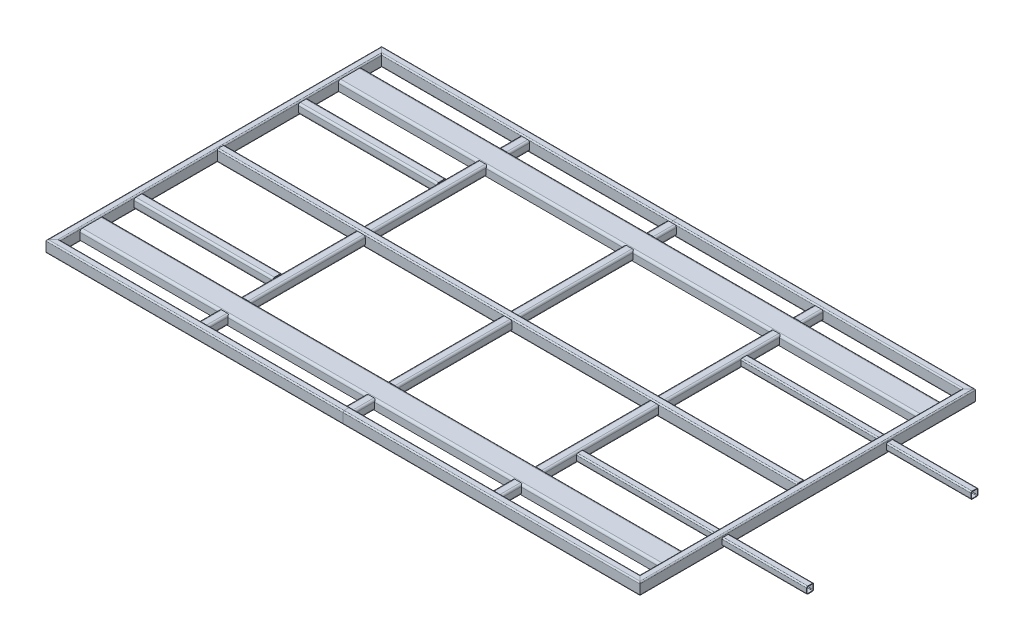
from build123d import *

# Parameters (mm, degrees)
RECTANGULAR_TUBE_CONFIGURED_50_X_30_X_DEPTH      = 1430.154759474
RECTANGULAR_TUBE_CONFIGURED_50_X_30_X_DEPTH_BACK = 30.154759474
RECTANGULAR_TUBE_CONFIGURED_50_X_3_4_DEPTH       = 1281.154759474
RECTANGULAR_TUBE_CONFIGURED_50_X_3_6_DEPTH       = 1281.154759474
RECTANGULAR_TUBE_CONFIGURED_50_X_3_8_DEPTH       = 1460.309518948
RECTANGULAR_TUBE_CONFIGURED_50_X_3_10_DEPTH      = 1281.154759474
RECTANGULAR_TUBE_CONFIGURED_50_X_3_13_DEPTH      = 1281.154759474
RECTANGULAR_TUBE_CONFIGURED_50_X_3_16_DEPTH      = 2502
BOSS_EXTRUDE1_DEPTH                              = 2470
FILLET1_R                                        = 10
CUT_EXTRUDE1_DEPTH                               = 30
FILLET1_OF_MIRROR1_R                             = 10
SQUARE_TUBE_CONFIGURED_40_X_40_X_4_1_DEPTH       = 105
SQUARE_TUBE_CONFIGURED_40_X_40_X_4_1_2_DEPTH     = 114.8
SQUARE_TUBE_CONFIGURED_40_X_40_X_4_1_3_DEPTH     = 105
SQUARE_TUBE_CONFIGURED_40_X_40_X_4_1_4_DEPTH     = 1010
SQUARE_TUBE_CONFIGURED_40_X_40_X_4_1_5_DEPTH     = 1010
SQUARE_TUBE_CONFIGURED_40_X_40_X_4_1_6_DEPTH     = 1010
SQUARE_TUBE_CONFIGURED_40_X_40_X_4_1_7_DEPTH     = 105
SQUARE_TUBE_CONFIGURED_40_X_40_X_4_1_8_DEPTH     = 105
SQUARE_TUBE_CONFIGURED_40_X_40_X_4_1_9_DEPTH     = 105
SQUARE_TUBE_CONFIGURED_40_X_40_X_4_1_1_DEPTH     = 626
SQUARE_TUBE_CONFIGURED_40_X_40_X_4_3_DEPTH       = 626
SQUARE_TUBE_CONFIGURED_30_X_30_X_2_6_1_DEPTH     = 1000
SQUARE_TUBE_CONFIGURED_30_X_30_X_2_2_DEPTH       = 1000


with BuildPart() as part:
    # Sketch1 → Rectangular tube - configured 50 X 30 X 2.6(1) (new, two sides: drawn at the far end of the back side and taken through both)
    with BuildSketch(Plane(origin=(-1250, 0, 0), x_dir=(1, 0, 0), z_dir=(0, 0, 1)).offset(-RECTANGULAR_TUBE_CONFIGURED_50_X_30_X_DEPTH_BACK)):
        with BuildLine():
            Line((-9.8, -25), (9.8, -25))
            ThreePointArc((9.8, -25), (13.476955262, -23.476955262), (15, -19.8))
            Line((15, -19.8), (15, 19.8))
            ThreePointArc((15, 19.8), (13.476955262, 23.476955262), (9.8, 25))
            Line((9.8, 25), (-9.8, 25))
            ThreePointArc((-9.8, 25), (-13.476955262, 23.476955262), (-15, 19.8))
            Line((-15, 19.8), (-15, -19.8))
            ThreePointArc((-15, -19.8), (-13.476955262, -23.476955262), (-9.8, -25))
        make_face()
        with BuildLine():
            Line((-9.8, -22.4), (9.8, -22.4))
            ThreePointArc((9.8, -22.4), (11.638477631, -21.638477631), (12.4, -19.8))
            Line((12.4, -19.8), (12.4, 19.8))
            ThreePointArc((12.4, 19.8), (11.638477631, 21.638477631), (9.8, 22.4))
            Line((9.8, 22.4), (-9.8, 22.4))
            ThreePointArc((-9.8, 22.4), (-11.638477631, 21.638477631), (-12.4, 19.8))
            Line((-12.4, 19.8), (-12.4, -19.8))
            ThreePointArc((-12.4, -19.8), (-11.638477631, -21.638477631), (-9.8, -22.4))
        make_face(mode=Mode.SUBTRACT)
    extrude(amount=RECTANGULAR_TUBE_CONFIGURED_50_X_30_X_DEPTH + RECTANGULAR_TUBE_CONFIGURED_50_X_30_X_DEPTH_BACK)

    # Rectangular tube - configured 50 X 3 2
    split(bisect_by=Plane(origin=(-1250, 0, 0), x_dir=(0, -1, 0), z_dir=(-0.707106781, 0, 0.707106781)), keep=Keep.TOP)

    # Rectangular tube - configured 50 X 3 3
    split(bisect_by=Plane(origin=(-1250, 0, 1400), x_dir=(0, -1, 0), z_dir=(-0.707106781, 0, -0.707106781)), keep=Keep.TOP)

    # Sketch115 → Cut-Extrude1 (cut, symmetric)
    with BuildSketch(Plane(origin=(-1235, 0, 0), x_dir=(0, 0, -1), z_dir=(1, 0, 0))):
        Polygon((-165, -28.2), (-135, -28.2), (-135, -11.8), (-108, -11.8), (-108, 11.8), (-192, 11.8), (-192, -11.8), (-165, -11.8), align=None)
    cut_extrude1 = extrude(amount=CUT_EXTRUDE1_DEPTH, both=True, mode=Mode.SUBTRACT)


with BuildPart() as body_2:
    # Sketch1 on segment 2 (carried to segment 2) → Rectangular tube - configured 50 X 3 4 (new body)
    with BuildSketch(Plane(origin=(-1280.154759474, 0, 1400), x_dir=(0, 0, -1), z_dir=(1, 0, 0))):
        with BuildLine():
            Line((-9.8, -25), (9.8, -25))
            ThreePointArc((9.8, -25), (13.476955262, -23.476955262), (15, -19.8))
            Line((15, -19.8), (15, 19.8))
            ThreePointArc((15, 19.8), (13.476955262, 23.476955262), (9.8, 25))
            Line((9.8, 25), (-9.8, 25))
            ThreePointArc((-9.8, 25), (-13.476955262, 23.476955262), (-15, 19.8))
            Line((-15, 19.8), (-15, -19.8))
            ThreePointArc((-15, -19.8), (-13.476955262, -23.476955262), (-9.8, -25))
        make_face()
        with BuildLine():
            Line((-9.8, -22.4), (9.8, -22.4))
            ThreePointArc((9.8, -22.4), (11.638477631, -21.638477631), (12.4, -19.8))
            Line((12.4, -19.8), (12.4, 19.8))
            ThreePointArc((12.4, 19.8), (11.638477631, 21.638477631), (9.8, 22.4))
            Line((9.8, 22.4), (-9.8, 22.4))
            ThreePointArc((-9.8, 22.4), (-11.638477631, 21.638477631), (-12.4, 19.8))
            Line((-12.4, 19.8), (-12.4, -19.8))
            ThreePointArc((-12.4, -19.8), (-11.638477631, -21.638477631), (-9.8, -22.4))
        make_face(mode=Mode.SUBTRACT)
    extrude(amount=RECTANGULAR_TUBE_CONFIGURED_50_X_3_4_DEPTH)

    # Rectangular tube - configured 50 X 3 4 m
    split(bisect_by=Plane(origin=(-1250, 0, 1400), x_dir=(0, 1, 0), z_dir=(0.707106781, 0, 0.707106781)), keep=Keep.TOP)

    # Rectangular tube - configured 50 X 3 5
    split(bisect_by=Plane(origin=(0, 0, 1400), x_dir=(0, -1, 0), z_dir=(-1, 0, 0)), keep=Keep.TOP)


with BuildPart() as body_3:
    # Sketch1 on segment 3 (carried to segment 3) → Rectangular tube - configured 50 X 3 6 (new body)
    with BuildSketch(Plane(origin=(-1, 0, 1400), x_dir=(0, 0, -1), z_dir=(1, 0, 0))):
        with BuildLine():
            Line((-9.8, -25), (9.8, -25))
            ThreePointArc((9.8, -25), (13.476955262, -23.476955262), (15, -19.8))
            Line((15, -19.8), (15, 19.8))
            ThreePointArc((15, 19.8), (13.476955262, 23.476955262), (9.8, 25))
            Line((9.8, 25), (-9.8, 25))
            ThreePointArc((-9.8, 25), (-13.476955262, 23.476955262), (-15, 19.8))
            Line((-15, 19.8), (-15, -19.8))
            ThreePointArc((-15, -19.8), (-13.476955262, -23.476955262), (-9.8, -25))
        make_face()
        with BuildLine():
            Line((-9.8, -22.4), (9.8, -22.4))
            ThreePointArc((9.8, -22.4), (11.638477631, -21.638477631), (12.4, -19.8))
            Line((12.4, -19.8), (12.4, 19.8))
            ThreePointArc((12.4, 19.8), (11.638477631, 21.638477631), (9.8, 22.4))
            Line((9.8, 22.4), (-9.8, 22.4))
            ThreePointArc((-9.8, 22.4), (-11.638477631, 21.638477631), (-12.4, 19.8))
            Line((-12.4, 19.8), (-12.4, -19.8))
            ThreePointArc((-12.4, -19.8), (-11.638477631, -21.638477631), (-9.8, -22.4))
        make_face(mode=Mode.SUBTRACT)
    extrude(amount=RECTANGULAR_TUBE_CONFIGURED_50_X_3_6_DEPTH)

    # Rectangular tube - configured 50 X 3 6 m
    split(bisect_by=Plane(origin=(0, 0, 1400), x_dir=(0, 1, 0), z_dir=(1, 0, 0)), keep=Keep.TOP)

    # Rectangular tube - configured 50 X 3 7
    split(bisect_by=Plane(origin=(1250, 0, 1400), x_dir=(0, -1, 0), z_dir=(-0.707106781, 0, 0.707106781)), keep=Keep.TOP)


with BuildPart() as body_4:
    # Sketch1 on segment 4 (carried to segment 4) → Rectangular tube - configured 50 X 3 8 (new body)
    with BuildSketch(Plane(origin=(1250, 0, 1430.154759474), x_dir=(-1, 0, 0), z_dir=(0, 0, -1))):
        with BuildLine():
            Line((-9.8, -25), (9.8, -25))
            ThreePointArc((9.8, -25), (13.476955262, -23.476955262), (15, -19.8))
            Line((15, -19.8), (15, 19.8))
            ThreePointArc((15, 19.8), (13.476955262, 23.476955262), (9.8, 25))
            Line((9.8, 25), (-9.8, 25))
            ThreePointArc((-9.8, 25), (-13.476955262, 23.476955262), (-15, 19.8))
            Line((-15, 19.8), (-15, -19.8))
            ThreePointArc((-15, -19.8), (-13.476955262, -23.476955262), (-9.8, -25))
        make_face()
        with BuildLine():
            Line((-9.8, -22.4), (9.8, -22.4))
            ThreePointArc((9.8, -22.4), (11.638477631, -21.638477631), (12.4, -19.8))
            Line((12.4, -19.8), (12.4, 19.8))
            ThreePointArc((12.4, 19.8), (11.638477631, 21.638477631), (9.8, 22.4))
            Line((9.8, 22.4), (-9.8, 22.4))
            ThreePointArc((-9.8, 22.4), (-11.638477631, 21.638477631), (-12.4, 19.8))
            Line((-12.4, 19.8), (-12.4, -19.8))
            ThreePointArc((-12.4, -19.8), (-11.638477631, -21.638477631), (-9.8, -22.4))
        make_face(mode=Mode.SUBTRACT)
    extrude(amount=RECTANGULAR_TUBE_CONFIGURED_50_X_3_8_DEPTH)

    # Rectangular tube - configured 50 X 3 8 m
    split(bisect_by=Plane(origin=(1250, 0, 0), x_dir=(0, 1, 0), z_dir=(0.707106781, 0, 0.707106781)), keep=Keep.TOP)

    # Rectangular tube - configured 50 X 3 9
    split(bisect_by=Plane(origin=(1250, 0, 1400), x_dir=(0, 1, 0), z_dir=(0.707106781, 0, -0.707106781)), keep=Keep.TOP)


with BuildPart() as body_5:
    # Sketch1 on segment 5 (carried to segment 5) → Rectangular tube - configured 50 X 3 10 (new body)
    with BuildSketch(Plane.ZY.offset(-1280.154759474)):
        with BuildLine():
            Line((-9.8, -25), (9.8, -25))
            ThreePointArc((9.8, -25), (13.476955262, -23.476955262), (15, -19.8))
            Line((15, -19.8), (15, 19.8))
            ThreePointArc((15, 19.8), (13.476955262, 23.476955262), (9.8, 25))
            Line((9.8, 25), (-9.8, 25))
            ThreePointArc((-9.8, 25), (-13.476955262, 23.476955262), (-15, 19.8))
            Line((-15, 19.8), (-15, -19.8))
            ThreePointArc((-15, -19.8), (-13.476955262, -23.476955262), (-9.8, -25))
        make_face()
        with BuildLine():
            Line((-9.8, -22.4), (9.8, -22.4))
            ThreePointArc((9.8, -22.4), (11.638477631, -21.638477631), (12.4, -19.8))
            Line((12.4, -19.8), (12.4, 19.8))
            ThreePointArc((12.4, 19.8), (11.638477631, 21.638477631), (9.8, 22.4))
            Line((9.8, 22.4), (-9.8, 22.4))
            ThreePointArc((-9.8, 22.4), (-11.638477631, 21.638477631), (-12.4, 19.8))
            Line((-12.4, 19.8), (-12.4, -19.8))
            ThreePointArc((-12.4, -19.8), (-11.638477631, -21.638477631), (-9.8, -22.4))
        make_face(mode=Mode.SUBTRACT)
    extrude(amount=RECTANGULAR_TUBE_CONFIGURED_50_X_3_10_DEPTH)

    # Rectangular tube - configured 50 X 3 11
    split(bisect_by=Plane.YZ, keep=Keep.TOP)

    # Rectangular tube - configured 50 X 3 12
    split(bisect_by=Plane(origin=(1250, 0, 0), x_dir=(0, -1, 0), z_dir=(-0.707106781, 0, -0.707106781)), keep=Keep.TOP)


with BuildPart() as body_6:
    # Sketch1 on segment 6 (carried to segment 6) → Rectangular tube - configured 50 X 3 13 (new body)
    with BuildSketch(Plane.ZY.offset(-1)):
        with BuildLine():
            Line((-9.8, -25), (9.8, -25))
            ThreePointArc((9.8, -25), (13.476955262, -23.476955262), (15, -19.8))
            Line((15, -19.8), (15, 19.8))
            ThreePointArc((15, 19.8), (13.476955262, 23.476955262), (9.8, 25))
            Line((9.8, 25), (-9.8, 25))
            ThreePointArc((-9.8, 25), (-13.476955262, 23.476955262), (-15, 19.8))
            Line((-15, 19.8), (-15, -19.8))
            ThreePointArc((-15, -19.8), (-13.476955262, -23.476955262), (-9.8, -25))
        make_face()
        with BuildLine():
            Line((-9.8, -22.4), (9.8, -22.4))
            ThreePointArc((9.8, -22.4), (11.638477631, -21.638477631), (12.4, -19.8))
            Line((12.4, -19.8), (12.4, 19.8))
            ThreePointArc((12.4, 19.8), (11.638477631, 21.638477631), (9.8, 22.4))
            Line((9.8, 22.4), (-9.8, 22.4))
            ThreePointArc((-9.8, 22.4), (-11.638477631, 21.638477631), (-12.4, 19.8))
            Line((-12.4, 19.8), (-12.4, -19.8))
            ThreePointArc((-12.4, -19.8), (-11.638477631, -21.638477631), (-9.8, -22.4))
        make_face(mode=Mode.SUBTRACT)
    extrude(amount=RECTANGULAR_TUBE_CONFIGURED_50_X_3_13_DEPTH)

    # Rectangular tube - configured 50 X 3 14
    split(bisect_by=Plane(origin=(-1250, 0, 0), x_dir=(0, 1, 0), z_dir=(0.707106781, 0, -0.707106781)), keep=Keep.TOP)

    # Rectangular tube - configured 50 X 3 15
    split(bisect_by=Plane(origin=(0, 0, 0), x_dir=(0, -1, 0), z_dir=(-1, 0, 0)), keep=Keep.TOP)


with BuildPart() as body_7:
    # Sketch1 on segment 7 (carried to segment 7) → Rectangular tube - configured 50 X 3 16 (new body)
    with BuildSketch(Plane(origin=(1251, 0, 700), x_dir=(0, 0, 1), z_dir=(-1, 0, 0))):
        with BuildLine():
            Line((-9.8, -25), (9.8, -25))
            ThreePointArc((9.8, -25), (13.476955262, -23.476955262), (15, -19.8))
            Line((15, -19.8), (15, 19.8))
            ThreePointArc((15, 19.8), (13.476955262, 23.476955262), (9.8, 25))
            Line((9.8, 25), (-9.8, 25))
            ThreePointArc((-9.8, 25), (-13.476955262, 23.476955262), (-15, 19.8))
            Line((-15, 19.8), (-15, -19.8))
            ThreePointArc((-15, -19.8), (-13.476955262, -23.476955262), (-9.8, -25))
        make_face()
        with BuildLine():
            Line((-9.8, -22.4), (9.8, -22.4))
            ThreePointArc((9.8, -22.4), (11.638477631, -21.638477631), (12.4, -19.8))
            Line((12.4, -19.8), (12.4, 19.8))
            ThreePointArc((12.4, 19.8), (11.638477631, 21.638477631), (9.8, 22.4))
            Line((9.8, 22.4), (-9.8, 22.4))
            ThreePointArc((-9.8, 22.4), (-11.638477631, 21.638477631), (-12.4, 19.8))
            Line((-12.4, 19.8), (-12.4, -19.8))
            ThreePointArc((-12.4, -19.8), (-11.638477631, -21.638477631), (-9.8, -22.4))
        make_face(mode=Mode.SUBTRACT)
    extrude(amount=RECTANGULAR_TUBE_CONFIGURED_50_X_3_16_DEPTH)

    # Rectangular tube - configured 50 X 3 17
    split(bisect_by=Plane(origin=(1235, 0, 700), x_dir=(0, -1, 0), z_dir=(-1, 0, 0)), keep=Keep.TOP)

    # Rectangular tube - configured 50 X 3 18
    split(bisect_by=Plane(origin=(-1235, 0, 700), x_dir=(0, 1, 0), z_dir=(1, 0, 0)), keep=Keep.TOP)


with BuildPart() as body_8:
    # Sketch113 → Boss-Extrude1 (new body)
    with BuildSketch(Plane(origin=(-1235, 0, 0), x_dir=(0, 0, -1), z_dir=(1, 0, 0))):
        Polygon((-200, 19.8), (-100, 19.8), (-100, -19.8), (-135, -19.8), (-135, -11.8), (-108, -11.8), (-108, 11.8), (-192, 11.8), (-192, -11.8), (-165, -11.8), (-165, -19.8), (-200, -19.8), align=None)
    boss_extrude1 = extrude(amount=BOSS_EXTRUDE1_DEPTH)

    # Fillet1
    fillet1_edges = [body_8.edges().sort_by_distance(p)[0] for p in [
        (0, 19.8, 100),
        (0, 19.8, 200),
    ]]
    fillet(fillet1_edges, radius=FILLET1_R)


with BuildPart() as part_1:
    add(part.part)

    # Mirror1: Boss-Extrude1 across plane
    add(boss_extrude1.mirror(Plane.XY.offset(700)))

    # Mirror1 2: Cut-Extrude1 across plane
    add(cut_extrude1.mirror(Plane.XY.offset(700)), mode=Mode.SUBTRACT)

    # Fillet1 of Mirror1
    fillet1_of_mirror1_edges = [part_1.edges().sort_by_distance(p)[0] for p in [
        (0, 19.8, 1300),
        (0, 19.8, 1200),
    ]]
    fillet(fillet1_of_mirror1_edges, radius=FILLET1_OF_MIRROR1_R)


with BuildPart() as body_9:
    # Sketch119 → Square tube - configured 40 X 40 X 4(1) (new body)
    with BuildSketch(Plane(origin=(-625, 0, 0), x_dir=(1, 0, 0), z_dir=(0, 0, 1))):
        with BuildLine():
            Line((-12, -20), (12, -20))
            ThreePointArc((12, -20), (17.656854249, -17.656854249), (20, -12))
            Line((20, -12), (20, 12))
            ThreePointArc((20, 12), (17.656854249, 17.656854249), (12, 20))
            Line((12, 20), (-12, 20))
            ThreePointArc((-12, 20), (-17.656854249, 17.656854249), (-20, 12))
            Line((-20, 12), (-20, -12))
            ThreePointArc((-20, -12), (-17.656854249, -17.656854249), (-12, -20))
        make_face()
        with BuildLine():
            Line((-12, -16), (12, -16))
            ThreePointArc((12, -16), (14.828427125, -14.828427125), (16, -12))
            Line((16, -12), (16, 12))
            ThreePointArc((16, 12), (14.828427125, 14.828427125), (12, 16))
            Line((12, 16), (-12, 16))
            ThreePointArc((-12, 16), (-14.828427125, 14.828427125), (-16, 12))
            Line((-16, 12), (-16, -12))
            ThreePointArc((-16, -12), (-14.828427125, -14.828427125), (-12, -16))
        make_face(mode=Mode.SUBTRACT)
    extrude(amount=SQUARE_TUBE_CONFIGURED_40_X_40_X_4_1_DEPTH)


with BuildPart() as body_10:
    # Sketch119 on segment 2 (carried to segment 2) → Square tube - configured 40 X 40 X 4_1 2 (new body)
    with BuildSketch(Plane.XY.offset(-9.8)):
        with BuildLine():
            Line((-12, -20), (12, -20))
            ThreePointArc((12, -20), (17.656854249, -17.656854249), (20, -12))
            Line((20, -12), (20, 12))
            ThreePointArc((20, 12), (17.656854249, 17.656854249), (12, 20))
            Line((12, 20), (-12, 20))
            ThreePointArc((-12, 20), (-17.656854249, 17.656854249), (-20, 12))
            Line((-20, 12), (-20, -12))
            ThreePointArc((-20, -12), (-17.656854249, -17.656854249), (-12, -20))
        make_face()
        with BuildLine():
            Line((-12, -16), (12, -16))
            ThreePointArc((12, -16), (14.828427125, -14.828427125), (16, -12))
            Line((16, -12), (16, 12))
            ThreePointArc((16, 12), (14.828427125, 14.828427125), (12, 16))
            Line((12, 16), (-12, 16))
            ThreePointArc((-12, 16), (-14.828427125, 14.828427125), (-16, 12))
            Line((-16, 12), (-16, -12))
            ThreePointArc((-16, -12), (-14.828427125, -14.828427125), (-12, -16))
        make_face(mode=Mode.SUBTRACT)
    extrude(amount=SQUARE_TUBE_CONFIGURED_40_X_40_X_4_1_2_DEPTH)


with BuildPart() as body_11:
    # Sketch119 on segment 3 (carried to segment 3) → Square tube - configured 40 X 40 X 4_1 3 (new body)
    with BuildSketch(Plane(origin=(625, 0, 0), x_dir=(1, 0, 0), z_dir=(0, 0, 1))):
        with BuildLine():
            Line((-12, -20), (12, -20))
            ThreePointArc((12, -20), (17.656854249, -17.656854249), (20, -12))
            Line((20, -12), (20, 12))
            ThreePointArc((20, 12), (17.656854249, 17.656854249), (12, 20))
            Line((12, 20), (-12, 20))
            ThreePointArc((-12, 20), (-17.656854249, 17.656854249), (-20, 12))
            Line((-20, 12), (-20, -12))
            ThreePointArc((-20, -12), (-17.656854249, -17.656854249), (-12, -20))
        make_face()
        with BuildLine():
            Line((-12, -16), (12, -16))
            ThreePointArc((12, -16), (14.828427125, -14.828427125), (16, -12))
            Line((16, -12), (16, 12))
            ThreePointArc((16, 12), (14.828427125, 14.828427125), (12, 16))
            Line((12, 16), (-12, 16))
            ThreePointArc((-12, 16), (-14.828427125, 14.828427125), (-16, 12))
            Line((-16, 12), (-16, -12))
            ThreePointArc((-16, -12), (-14.828427125, -14.828427125), (-12, -16))
        make_face(mode=Mode.SUBTRACT)
    extrude(amount=SQUARE_TUBE_CONFIGURED_40_X_40_X_4_1_3_DEPTH)


with BuildPart() as body_12:
    # Sketch119 on segment 4 (carried to segment 4) → Square tube - configured 40 X 40 X 4_1 4 (new body)
    with BuildSketch(Plane(origin=(625, 0, 195), x_dir=(1, 0, 0), z_dir=(0, 0, 1))):
        with BuildLine():
            Line((-12, -20), (12, -20))
            ThreePointArc((12, -20), (17.656854249, -17.656854249), (20, -12))
            Line((20, -12), (20, 12))
            ThreePointArc((20, 12), (17.656854249, 17.656854249), (12, 20))
            Line((12, 20), (-12, 20))
            ThreePointArc((-12, 20), (-17.656854249, 17.656854249), (-20, 12))
            Line((-20, 12), (-20, -12))
            ThreePointArc((-20, -12), (-17.656854249, -17.656854249), (-12, -20))
        make_face()
        with BuildLine():
            Line((-12, -16), (12, -16))
            ThreePointArc((12, -16), (14.828427125, -14.828427125), (16, -12))
            Line((16, -12), (16, 12))
            ThreePointArc((16, 12), (14.828427125, 14.828427125), (12, 16))
            Line((12, 16), (-12, 16))
            ThreePointArc((-12, 16), (-14.828427125, 14.828427125), (-16, 12))
            Line((-16, 12), (-16, -12))
            ThreePointArc((-16, -12), (-14.828427125, -14.828427125), (-12, -16))
        make_face(mode=Mode.SUBTRACT)
    extrude(amount=SQUARE_TUBE_CONFIGURED_40_X_40_X_4_1_4_DEPTH)


with BuildPart() as body_13:
    # Sketch119 on segment 5 (carried to segment 5) → Square tube - configured 40 X 40 X 4_1 5 (new body)
    with BuildSketch(Plane.XY.offset(195)):
        with BuildLine():
            Line((-12, -20), (12, -20))
            ThreePointArc((12, -20), (17.656854249, -17.656854249), (20, -12))
            Line((20, -12), (20, 12))
            ThreePointArc((20, 12), (17.656854249, 17.656854249), (12, 20))
            Line((12, 20), (-12, 20))
            ThreePointArc((-12, 20), (-17.656854249, 17.656854249), (-20, 12))
            Line((-20, 12), (-20, -12))
            ThreePointArc((-20, -12), (-17.656854249, -17.656854249), (-12, -20))
        make_face()
        with BuildLine():
            Line((-12, -16), (12, -16))
            ThreePointArc((12, -16), (14.828427125, -14.828427125), (16, -12))
            Line((16, -12), (16, 12))
            ThreePointArc((16, 12), (14.828427125, 14.828427125), (12, 16))
            Line((12, 16), (-12, 16))
            ThreePointArc((-12, 16), (-14.828427125, 14.828427125), (-16, 12))
            Line((-16, 12), (-16, -12))
            ThreePointArc((-16, -12), (-14.828427125, -14.828427125), (-12, -16))
        make_face(mode=Mode.SUBTRACT)
    extrude(amount=SQUARE_TUBE_CONFIGURED_40_X_40_X_4_1_5_DEPTH)


with BuildPart() as body_14:
    # Sketch119 on segment 6 (carried to segment 6) → Square tube - configured 40 X 40 X 4_1 6 (new body)
    with BuildSketch(Plane(origin=(-625, 0, 195), x_dir=(1, 0, 0), z_dir=(0, 0, 1))):
        with BuildLine():
            Line((-12, -20), (12, -20))
            ThreePointArc((12, -20), (17.656854249, -17.656854249), (20, -12))
            Line((20, -12), (20, 12))
            ThreePointArc((20, 12), (17.656854249, 17.656854249), (12, 20))
            Line((12, 20), (-12, 20))
            ThreePointArc((-12, 20), (-17.656854249, 17.656854249), (-20, 12))
            Line((-20, 12), (-20, -12))
            ThreePointArc((-20, -12), (-17.656854249, -17.656854249), (-12, -20))
        make_face()
        with BuildLine():
            Line((-12, -16), (12, -16))
            ThreePointArc((12, -16), (14.828427125, -14.828427125), (16, -12))
            Line((16, -12), (16, 12))
            ThreePointArc((16, 12), (14.828427125, 14.828427125), (12, 16))
            Line((12, 16), (-12, 16))
            ThreePointArc((-12, 16), (-14.828427125, 14.828427125), (-16, 12))
            Line((-16, 12), (-16, -12))
            ThreePointArc((-16, -12), (-14.828427125, -14.828427125), (-12, -16))
        make_face(mode=Mode.SUBTRACT)
    extrude(amount=SQUARE_TUBE_CONFIGURED_40_X_40_X_4_1_6_DEPTH)


with BuildPart() as body_15:
    # Sketch119 on segment 7 (carried to segment 7) → Square tube - configured 40 X 40 X 4_1 7 (new body)
    with BuildSketch(Plane(origin=(-625, 0, 1295), x_dir=(1, 0, 0), z_dir=(0, 0, 1))):
        with BuildLine():
            Line((-12, -20), (12, -20))
            ThreePointArc((12, -20), (17.656854249, -17.656854249), (20, -12))
            Line((20, -12), (20, 12))
            ThreePointArc((20, 12), (17.656854249, 17.656854249), (12, 20))
            Line((12, 20), (-12, 20))
            ThreePointArc((-12, 20), (-17.656854249, 17.656854249), (-20, 12))
            Line((-20, 12), (-20, -12))
            ThreePointArc((-20, -12), (-17.656854249, -17.656854249), (-12, -20))
        make_face()
        with BuildLine():
            Line((-12, -16), (12, -16))
            ThreePointArc((12, -16), (14.828427125, -14.828427125), (16, -12))
            Line((16, -12), (16, 12))
            ThreePointArc((16, 12), (14.828427125, 14.828427125), (12, 16))
            Line((12, 16), (-12, 16))
            ThreePointArc((-12, 16), (-14.828427125, 14.828427125), (-16, 12))
            Line((-16, 12), (-16, -12))
            ThreePointArc((-16, -12), (-14.828427125, -14.828427125), (-12, -16))
        make_face(mode=Mode.SUBTRACT)
    extrude(amount=SQUARE_TUBE_CONFIGURED_40_X_40_X_4_1_7_DEPTH)


with BuildPart() as body_16:
    # Sketch119 on segment 8 (carried to segment 8) → Square tube - configured 40 X 40 X 4_1 8 (new body)
    with BuildSketch(Plane.XY.offset(1295)):
        with BuildLine():
            Line((-12, -20), (12, -20))
            ThreePointArc((12, -20), (17.656854249, -17.656854249), (20, -12))
            Line((20, -12), (20, 12))
            ThreePointArc((20, 12), (17.656854249, 17.656854249), (12, 20))
            Line((12, 20), (-12, 20))
            ThreePointArc((-12, 20), (-17.656854249, 17.656854249), (-20, 12))
            Line((-20, 12), (-20, -12))
            ThreePointArc((-20, -12), (-17.656854249, -17.656854249), (-12, -20))
        make_face()
        with BuildLine():
            Line((-12, -16), (12, -16))
            ThreePointArc((12, -16), (14.828427125, -14.828427125), (16, -12))
            Line((16, -12), (16, 12))
            ThreePointArc((16, 12), (14.828427125, 14.828427125), (12, 16))
            Line((12, 16), (-12, 16))
            ThreePointArc((-12, 16), (-14.828427125, 14.828427125), (-16, 12))
            Line((-16, 12), (-16, -12))
            ThreePointArc((-16, -12), (-14.828427125, -14.828427125), (-12, -16))
        make_face(mode=Mode.SUBTRACT)
    extrude(amount=SQUARE_TUBE_CONFIGURED_40_X_40_X_4_1_8_DEPTH)


with BuildPart() as body_17:
    # Sketch119 on segment 9 (carried to segment 9) → Square tube - configured 40 X 40 X 4_1 9 (new body)
    with BuildSketch(Plane(origin=(625, 0, 1295), x_dir=(1, 0, 0), z_dir=(0, 0, 1))):
        with BuildLine():
            Line((-12, -20), (12, -20))
            ThreePointArc((12, -20), (17.656854249, -17.656854249), (20, -12))
            Line((20, -12), (20, 12))
            ThreePointArc((20, 12), (17.656854249, 17.656854249), (12, 20))
            Line((12, 20), (-12, 20))
            ThreePointArc((-12, 20), (-17.656854249, 17.656854249), (-20, 12))
            Line((-20, 12), (-20, -12))
            ThreePointArc((-20, -12), (-17.656854249, -17.656854249), (-12, -20))
        make_face()
        with BuildLine():
            Line((-12, -16), (12, -16))
            ThreePointArc((12, -16), (14.828427125, -14.828427125), (16, -12))
            Line((16, -12), (16, 12))
            ThreePointArc((16, 12), (14.828427125, 14.828427125), (12, 16))
            Line((12, 16), (-12, 16))
            ThreePointArc((-12, 16), (-14.828427125, 14.828427125), (-16, 12))
            Line((-16, 12), (-16, -12))
            ThreePointArc((-16, -12), (-14.828427125, -14.828427125), (-12, -16))
        make_face(mode=Mode.SUBTRACT)
    extrude(amount=SQUARE_TUBE_CONFIGURED_40_X_40_X_4_1_9_DEPTH)


with BuildPart() as body_18:
    # Sketch119 on segment 10 (carried to segment 10) → Square tube - configured 40 X 40 X 4_1 1 (new body)
    with BuildSketch(Plane(origin=(-1250, 0, 350), x_dir=(0, 0, -1), z_dir=(1, 0, 0))):
        with BuildLine():
            Line((-12, -20), (12, -20))
            ThreePointArc((12, -20), (17.656854249, -17.656854249), (20, -12))
            Line((20, -12), (20, 12))
            ThreePointArc((20, 12), (17.656854249, 17.656854249), (12, 20))
            Line((12, 20), (-12, 20))
            ThreePointArc((-12, 20), (-17.656854249, 17.656854249), (-20, 12))
            Line((-20, 12), (-20, -12))
            ThreePointArc((-20, -12), (-17.656854249, -17.656854249), (-12, -20))
        make_face()
        with BuildLine():
            Line((-12, -16), (12, -16))
            ThreePointArc((12, -16), (14.828427125, -14.828427125), (16, -12))
            Line((16, -12), (16, 12))
            ThreePointArc((16, 12), (14.828427125, 14.828427125), (12, 16))
            Line((12, 16), (-12, 16))
            ThreePointArc((-12, 16), (-14.828427125, 14.828427125), (-16, 12))
            Line((-16, 12), (-16, -12))
            ThreePointArc((-16, -12), (-14.828427125, -14.828427125), (-12, -16))
        make_face(mode=Mode.SUBTRACT)
    extrude(amount=SQUARE_TUBE_CONFIGURED_40_X_40_X_4_1_1_DEPTH)

    # Square tube - configured 40 X 40 X 4 2
    split(bisect_by=Plane(origin=(-645, 0, 350), x_dir=(0, -1, 0), z_dir=(-1, 0, 0)), keep=Keep.TOP)


with BuildPart() as body_19:
    # Sketch119 on segment 11 (carried to segment 11) → Square tube - configured 40 X 40 X 4 3 (new body)
    with BuildSketch(Plane(origin=(-1250, 0, 1050), x_dir=(0, 0, -1), z_dir=(1, 0, 0))):
        with BuildLine():
            Line((-12, -20), (12, -20))
            ThreePointArc((12, -20), (17.656854249, -17.656854249), (20, -12))
            Line((20, -12), (20, 12))
            ThreePointArc((20, 12), (17.656854249, 17.656854249), (12, 20))
            Line((12, 20), (-12, 20))
            ThreePointArc((-12, 20), (-17.656854249, 17.656854249), (-20, 12))
            Line((-20, 12), (-20, -12))
            ThreePointArc((-20, -12), (-17.656854249, -17.656854249), (-12, -20))
        make_face()
        with BuildLine():
            Line((-12, -16), (12, -16))
            ThreePointArc((12, -16), (14.828427125, -14.828427125), (16, -12))
            Line((16, -12), (16, 12))
            ThreePointArc((16, 12), (14.828427125, 14.828427125), (12, 16))
            Line((12, 16), (-12, 16))
            ThreePointArc((-12, 16), (-14.828427125, 14.828427125), (-16, 12))
            Line((-16, 12), (-16, -12))
            ThreePointArc((-16, -12), (-14.828427125, -14.828427125), (-12, -16))
        make_face(mode=Mode.SUBTRACT)
    extrude(amount=SQUARE_TUBE_CONFIGURED_40_X_40_X_4_3_DEPTH)

    # Square tube - configured 40 X 40 X 4 3 e
    split(bisect_by=Plane(origin=(-645, 0, 1050), x_dir=(0, -1, 0), z_dir=(-1, 0, 0)), keep=Keep.TOP)


with BuildPart() as body_20:
    # Sketch120 → Square tube - configured 30 X 30 X 2.6(1) (new body)
    with BuildSketch(Plane(origin=(625, 0, 350), x_dir=(0, 0, -1), z_dir=(1, 0, 0))):
        with BuildLine():
            Line((-9.8, -15), (9.8, -15))
            ThreePointArc((9.8, -15), (13.476955262, -13.476955262), (15, -9.8))
            Line((15, -9.8), (15, 9.8))
            ThreePointArc((15, 9.8), (13.476955262, 13.476955262), (9.8, 15))
            Line((9.8, 15), (-9.8, 15))
            ThreePointArc((-9.8, 15), (-13.476955262, 13.476955262), (-15, 9.8))
            Line((-15, 9.8), (-15, -9.8))
            ThreePointArc((-15, -9.8), (-13.476955262, -13.476955262), (-9.8, -15))
        make_face()
        with BuildLine():
            Line((-9.8, -12.4), (9.8, -12.4))
            ThreePointArc((9.8, -12.4), (11.638477631, -11.638477631), (12.4, -9.8))
            Line((12.4, -9.8), (12.4, 9.8))
            ThreePointArc((12.4, 9.8), (11.638477631, 11.638477631), (9.8, 12.4))
            Line((9.8, 12.4), (-9.8, 12.4))
            ThreePointArc((-9.8, 12.4), (-11.638477631, 11.638477631), (-12.4, 9.8))
            Line((-12.4, 9.8), (-12.4, -9.8))
            ThreePointArc((-12.4, -9.8), (-11.638477631, -11.638477631), (-9.8, -12.4))
        make_face(mode=Mode.SUBTRACT)
    extrude(amount=SQUARE_TUBE_CONFIGURED_30_X_30_X_2_6_1_DEPTH)


with BuildPart() as body_21:
    # Sketch120 on segment 2 (carried to segment 2) → Square tube - configured 30 X 30 X 2 2 (new body)
    with BuildSketch(Plane(origin=(625, 0, 1050), x_dir=(0, 0, -1), z_dir=(1, 0, 0))):
        with BuildLine():
            Line((-9.8, -15), (9.8, -15))
            ThreePointArc((9.8, -15), (13.476955262, -13.476955262), (15, -9.8))
            Line((15, -9.8), (15, 9.8))
            ThreePointArc((15, 9.8), (13.476955262, 13.476955262), (9.8, 15))
            Line((9.8, 15), (-9.8, 15))
            ThreePointArc((-9.8, 15), (-13.476955262, 13.476955262), (-15, 9.8))
            Line((-15, 9.8), (-15, -9.8))
            ThreePointArc((-15, -9.8), (-13.476955262, -13.476955262), (-9.8, -15))
        make_face()
        with BuildLine():
            Line((-9.8, -12.4), (9.8, -12.4))
            ThreePointArc((9.8, -12.4), (11.638477631, -11.638477631), (12.4, -9.8))
            Line((12.4, -9.8), (12.4, 9.8))
            ThreePointArc((12.4, 9.8), (11.638477631, 11.638477631), (9.8, 12.4))
            Line((9.8, 12.4), (-9.8, 12.4))
            ThreePointArc((-9.8, 12.4), (-11.638477631, 11.638477631), (-12.4, 9.8))
            Line((-12.4, 9.8), (-12.4, -9.8))
            ThreePointArc((-12.4, -9.8), (-11.638477631, -11.638477631), (-9.8, -12.4))
        make_face(mode=Mode.SUBTRACT)
    extrude(amount=SQUARE_TUBE_CONFIGURED_30_X_30_X_2_2_DEPTH)


solid = Compound([body_2.part, body_3.part, body_4.part, body_5.part, body_6.part, body_7.part, body_8.part, part_1.part, body_9.part, body_10.part, body_11.part, body_12.part, body_13.part, body_14.part, body_15.part, body_16.part, body_17.part, body_18.part, body_19.part, body_20.part, body_21.part])
